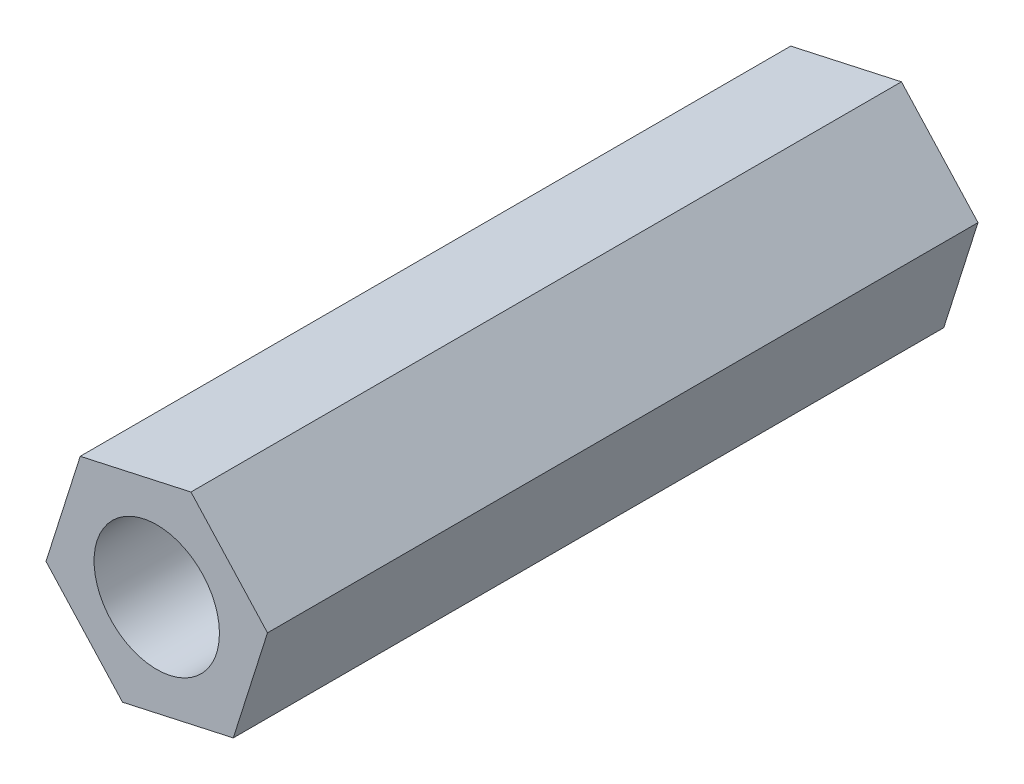
from build123d import *

# Parameters (mm, degrees)
SKETCH_1_R      = 1.5
EXTRUDE_1_DEPTH = 17


with BuildPart() as part:
    # 草图1 → 凸台-拉伸1 (new body)
    with BuildSketch(Plane.XY):
        Polygon((2.649803949, 0.584698524), (0.818538199, 2.587146797), (-1.83126575, 2.002448273), (-2.649803949, -0.584698524), (-0.818538199, -2.587146797), (1.83126575, -2.002448273), align=None)
        Circle(SKETCH_1_R, mode=Mode.SUBTRACT)
    extrude(amount=EXTRUDE_1_DEPTH)


solid = part.part
